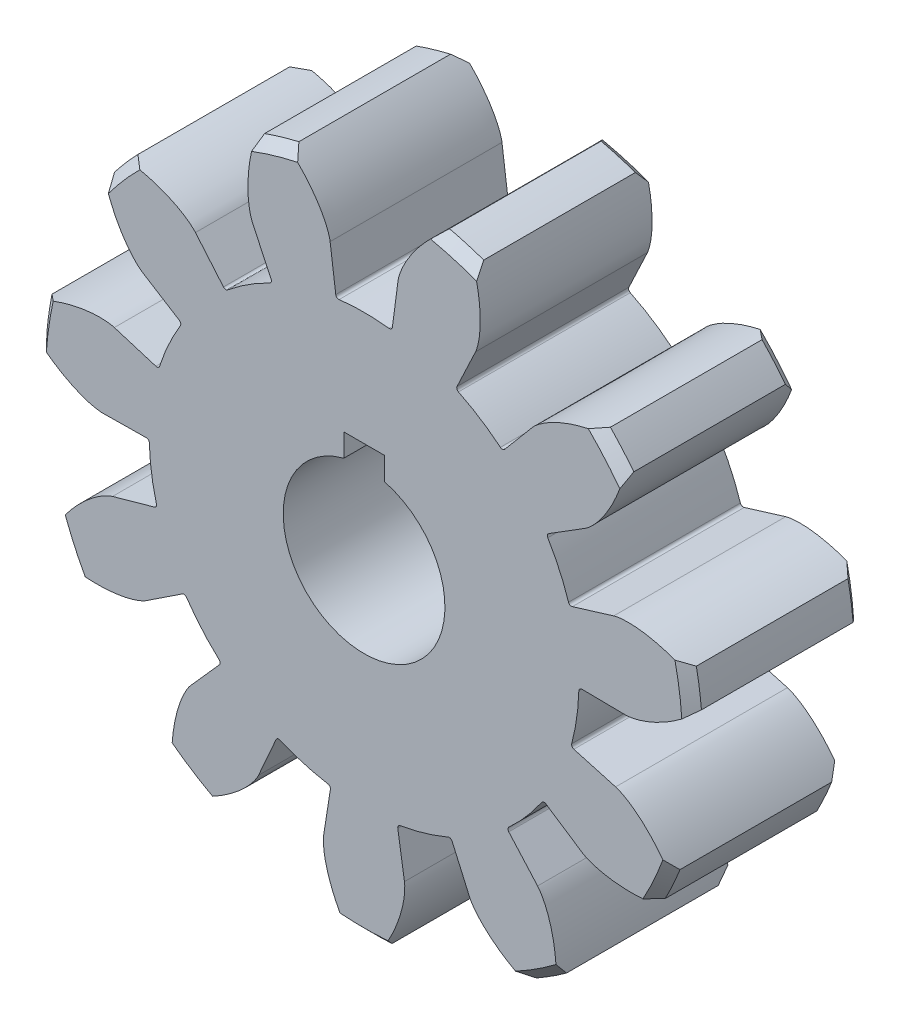
from build123d import *

# Parameters (mm, degrees)
SKETCH_1136_R                    = 32.5
EXTRUDE_1162_DEPTH               = 8.5
CHAMFER_1201_SIZE                = 1
CUT_EXTRUDE_1597_DEPTH           = 8.5
FILLET_2_R                       = 0.3
PATTERN_CIRCULAR_2_COUNT         = 11
FILLET_2_OF_PATTERN_CIRCULAR_2_R = 0.3
CUT_EXTRUDE_2_DEPTH              = 49.920966676


with BuildPart() as part:
    # Sketch 1136 → Extrude 1162 (new, symmetric)
    with BuildSketch(Plane.XY):
        Circle(SKETCH_1136_R)
    extrude(amount=EXTRUDE_1162_DEPTH, both=True)

    # Chamfer 1201
    chamfer_1201_edges = [part.edges().sort_by_distance(p)[0] for p in [
        (-32.5, 0, -8.5),
        (-32.5, 0, 8.5),
    ]]
    chamfer(chamfer_1201_edges, length=CHAMFER_1201_SIZE)

    # Sketch 1282 → Cut-Extrude 1597 (cut, symmetric)
    with BuildSketch(Plane.XY):
        with BuildLine():
            ThreePointArc((-2.761870653, 21.069754875), (0, 21.25), (2.761870653, 21.069754875))
            Line((2.761870653, 21.069754875), (3.358635787, 25.622355877))
            add(Edge.make_bspline(
                [(3.358635787, 25.622355877), (3.365026062, 25.671105998), (3.380794986, 25.76807854), (3.424204278, 25.959920016), (3.504145326, 26.2338524), (3.612363884, 26.540223796), (3.78504771, 26.959147625), (3.992775823, 27.39169014), (4.240409496, 27.844422082), (4.594604559, 28.42130214), (5.253268353, 29.3744677), (6.012256268, 30.270132371), (6.751973766, 31.01181313), (7.344716658, 31.543765411), (7.448313729, 31.634990479)],
                knots=[0, 0, 0, 0, 0, 0.001401017, 0.002802034, 0.005604068, 0.008132613, 0.010661158, 0.015718248, 0.019278665, 0.022839082, 0.029959916, 0.048733667, 0.052669882, 0.052669882, 0.052669882, 0.052669882, 0.052669882], degree=4))
            ThreePointArc((7.448313729, 31.634990479), (0, 32.5), (-7.448313729, 31.634990479))
            add(Edge.make_bspline(
                [(-3.358635787, 25.622355877), (-3.365026062, 25.671105998), (-3.380794986, 25.76807854), (-3.424204278, 25.959920016), (-3.504145326, 26.2338524), (-3.612363884, 26.540223796), (-3.78504771, 26.959147625), (-3.992775823, 27.39169014), (-4.240409496, 27.844422082), (-4.594604559, 28.42130214), (-5.253268353, 29.3744677), (-6.012256268, 30.270132371), (-6.751973766, 31.01181313), (-7.344716658, 31.543765411), (-7.448313729, 31.634990479)],
                knots=[0, 0, 0, 0, 0, 0.001401017, 0.002802034, 0.005604068, 0.008132613, 0.010661158, 0.015718248, 0.019278665, 0.022839082, 0.029959916, 0.048733667, 0.052669882, 0.052669882, 0.052669882, 0.052669882, 0.052669882], degree=4))
            Line((-3.358635787, 25.622355877), (-2.761870653, 21.069754875))
        make_face()
    cut_extrude_1597 = extrude(amount=CUT_EXTRUDE_1597_DEPTH, both=True, mode=Mode.SUBTRACT)

    # 圆角2
    fillet_2_edges = [part.edges().sort_by_distance(p)[0] for p in [
        (2.761870653, 21.069754875, 0),
        (-2.761870653, 21.069754875, 0),
    ]]
    fillet(fillet_2_edges, radius=FILLET_2_R)

    # 圆周阵列2: Cut-Extrude 1597 ×11 about axis
    pattern_circular_2_axis = Axis((0, 0, 8.5), (0, 0, -1))
    for i in range(1, PATTERN_CIRCULAR_2_COUNT):
        add(cut_extrude_1597.rotate(pattern_circular_2_axis, i * 360 / PATTERN_CIRCULAR_2_COUNT), mode=Mode.SUBTRACT)

    # 圆角2 of 圆周阵列2
    fillet_2_of_pattern_circular_2_edges = [part.edges().sort_by_distance(p)[0] for p in [
        (13.714602943, 16.231825717, 0),
        (9.067736055, 19.218185732, 0),
        (20.313045702, 6.240406583, 0),
        (18.018400636, 11.264978408, 0),
        (20.462239975, -5.732297549, 0),
        (21.248350326, -0.264779966, 0),
        (14.114817636, -15.885037712, 0),
        (17.732098921, -11.710472571, 0),
        (3.286040428, -20.994390639, 0),
        (8.586031398, -19.438172878, 0),
        (-8.586031398, -19.438172878, 0),
        (-3.286040428, -20.994390639, 0),
        (-17.732098921, -11.710472571, 0),
        (-14.114817636, -15.885037712, 0),
        (-21.248350326, -0.264779966, 0),
        (-20.462239975, -5.732297549, 0),
        (-18.018400636, 11.264978408, 0),
        (-20.313045702, 6.240406583, 0),
        (-9.067736055, 19.218185732, 0),
        (-13.714602943, 16.231825717, 0),
    ]]
    fillet(fillet_2_of_pattern_circular_2_edges, radius=FILLET_2_OF_PATTERN_CIRCULAR_2_R)

    # 草图1 → 切除-拉伸2 (cut, through all)
    with BuildSketch(Plane.XY.offset(8.5)):
        with BuildLine():
            ThreePointArc((2, 7.745966692), (0, 8), (-2, 7.745966692))
            Line((-2, 7.745966692), (-2, 6))
            Line((-2, 6), (2, 6))
            Line((2, 6), (2, 7.745966692))
        make_face()
        with BuildLine():
            Line((-2, 6), (-2, 7.745966692))
            ThreePointArc((-2, 7.745966692), (-4.898979486, -6.32455532), (8, 0))
            ThreePointArc((8, 0), (6.32455532, 4.898979486), (2, 7.745966692))
            Line((2, 7.745966692), (2, 6))
            Line((2, 6), (-2, 6))
        make_face()
        with BuildLine():
            Line((2, 10), (-2, 10))
            Line((-2, 10), (-2, 7.745966692))
            ThreePointArc((-2, 7.745966692), (0, 8), (2, 7.745966692))
            Line((2, 7.745966692), (2, 10))
        make_face()
    extrude(amount=-CUT_EXTRUDE_2_DEPTH, mode=Mode.SUBTRACT)


solid = part.part
